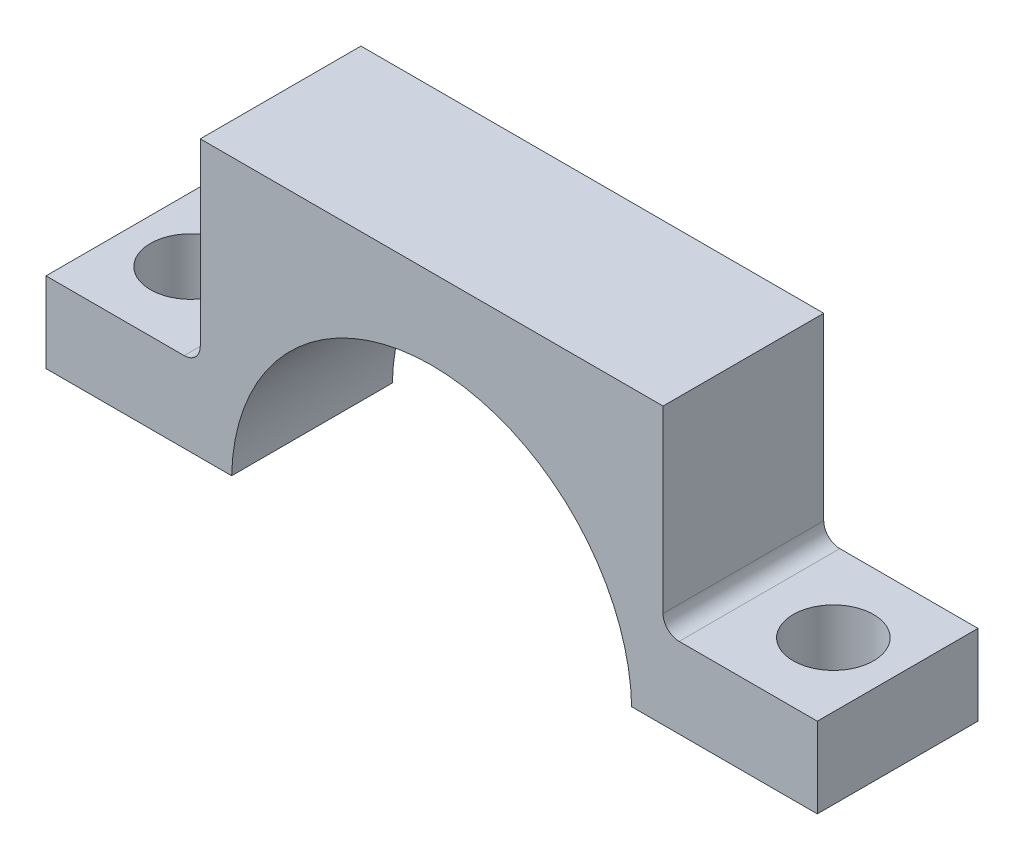
from build123d import *

# Parameters (mm, degrees)
EXTRUDE_1_DEPTH = 5
SKETCH_3_W      = 9.6
SKETCH_3_H      = 10
SKETCH_3_R      = 2.5
EXTRUDE_2_DEPTH = 5
FILLET_1_R      = 1


with BuildPart() as part:
    # 草图1 → 凸台-拉伸1 (new, symmetric)
    with BuildSketch(Plane.XY):
        with BuildLine():
            Line((12.447157347, 0.266033793), (14.4, 0.266033793))
            Line((14.4, 0.266033793), (14.4, 17.45))
            Line((14.4, 17.45), (-14.4, 17.45))
            Line((-14.4, 17.45), (-14.4, 0.266033793))
            Line((-14.4, 0.266033793), (-12.447157347, 0.266033793))
            ThreePointArc((-12.447157347, 0.266033793), (0, 12.45), (12.447157347, 0.266033793))
        make_face()
    extrude(amount=EXTRUDE_1_DEPTH, both=True)

    # 草图3 → 凸台-拉伸2 (add)
    # profile 1 of 2: a face of its own
    with BuildSketch(Plane.XZ.offset(-0.266033793)):
        with Locations((19.2, 0)):
            Rectangle(SKETCH_3_W, SKETCH_3_H)
        with Locations(Location((20, 0, 0), (0, 0, 90))):
            Circle(SKETCH_3_R, mode=Mode.SUBTRACT)
    # profile 2 of 2: a face of its own
    with BuildSketch(Plane.XZ.offset(-0.266033793)):
        with Locations((-19.2, 0)):
            Rectangle(SKETCH_3_W, SKETCH_3_H)
        with Locations(Location((-20, 0, 0), (0, 0, 270))):
            Circle(SKETCH_3_R, mode=Mode.SUBTRACT)
    extrude(amount=-EXTRUDE_2_DEPTH)

    # 圆角1
    fillet_1_edges = [part.edges().sort_by_distance(p)[0] for p in [
        (14.4, 5.266033793, 0),
        (-14.4, 5.266033793, 0),
    ]]
    fillet(fillet_1_edges, radius=FILLET_1_R)


solid = part.part
